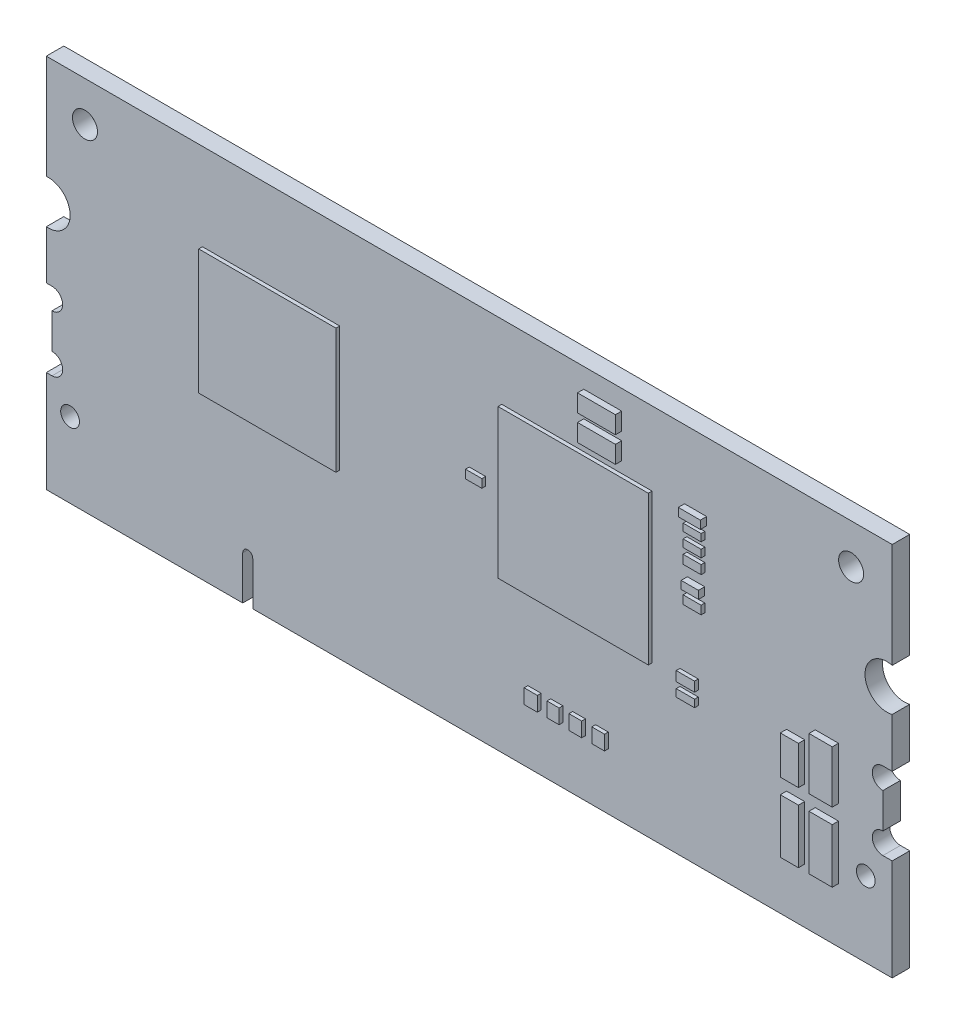
from build123d import *

# Parameters (mm, degrees)
SKETCH1_W         = 67.6
SKETCH1_H         = 30
SUBSTRATE_DEPTH   = 1.4
SKETCH2_R         = 1
SKETCH2_R_2       = 0.75
SKETCH2_R_3       = 1.75
CUTOUTS_DEPTH     = 2
SKETCH3_W         = 12.009016129
SKETCH3_H         = 11.886366808
SKETCH3_W_2       = 10.970861006
SKETCH3_H_2       = 9.979144757
CHIPS_DEPTH       = 0.3
SKETCH4_W         = 3.027468224
SKETCH4_H         = 1.391658781
SKETCH4_H_2       = 1.39165878
SKETCH4_W_2       = 1.760997679
SKETCH4_H_3       = 0.651327909
SKETCH4_W_3       = 1.447395353
SKETCH4_H_4       = 3.063653498
SKETCH4_W_4       = 1.857490704
SKETCH4_H_5       = 4.173323269
SKETCH4_H_6       = 4.331448702
SKETCH4_W_5       = 1.380452242
SKETCH4_H_7       = 0.625805016
CAPACITORS_DEPTH  = 0.5
SKETCH5_W         = 1.436881646
SKETCH5_H         = 0.57938776
SKETCH5_H_2       = 0.602563271
SKETCH5_H_3       = 0.695265312
SKETCH5_H_4       = 0.672089802
SKETCH5_W_2       = 1.465504975
SKETCH5_H_5       = 0.595361396
SKETCH5_W_3       = 1.305099019
SKETCH5_H_6       = 0.770620802
RESISTORS_DEPTH   = 0.3
SKETCH6_W         = 1.05591146
SKETCH6_H         = 1.163292287
SKETCH6_W_2       = 0.966427438
SKETCH6_W_3       = 1.020117852
SKETCH6_W_4       = 1.020117851
L_COMPONENT_DEPTH = 0.3


with BuildPart() as part:
    # Sketch1 → Substrate (new body)
    with BuildSketch(Plane.XY):
        Rectangle(SKETCH1_W, SKETCH1_H)
    extrude(amount=SUBSTRATE_DEPTH)

    # Sketch2 → Cutouts (cut)
    with BuildSketch(Plane.XY.offset(1.4)):
        with Locations((-30.709168608, 11.804578588)):
            Circle(SKETCH2_R)
        with Locations((30.516911038, 11.804578588)):
            Circle(SKETCH2_R)
        with Locations((31.687531572, -8.991184565)):
            Circle(SKETCH2_R_2)
        with Locations((-31.899083746, -8.991184565)):
            Circle(SKETCH2_R_2)
        with Locations((-33.643638543, 4.936384587)):
            Circle(SKETCH2_R_3)
        with Locations((33.376123728, 4.936384587)):
            Circle(SKETCH2_R_3)
        with BuildLine():
            Line((-18.1, -15), (-18.1, -11.517203937))
            ThreePointArc((-18.1, -11.517203937), (-17.7, -11.117203937), (-17.3, -11.517203937))
            Line((-17.3, -11.517203937), (-17.3, -15))
            Line((-17.3, -15), (-18.1, -15))
        make_face()
        with BuildLine():
            Line((33.057190194, -0.69758335), (34.638090789, -0.69758335))
            Line((34.638090789, -0.69758335), (34.710836401, -6.89758335))
            Line((34.710836401, -6.89758335), (33.057190194, -6.89758335))
            ThreePointArc((33.057190194, -6.89758335), (32.207190194, -6.04758335), (33.057190194, -5.19758335))
            Line((33.057190194, -5.19758335), (33.057190194, -2.39758335))
            ThreePointArc((33.057190194, -2.39758335), (32.207190194, -1.54758335), (33.057190194, -0.69758335))
        make_face()
        with BuildLine():
            Line((-33.341181022, -5.19758335), (-33.341181022, -2.39758335))
            ThreePointArc((-33.341181022, -2.39758335), (-32.491181022, -1.54758335), (-33.341181022, -0.69758335))
            Line((-33.341181022, -0.69758335), (-34.347477131, -0.69758335))
            Line((-34.347477131, -0.69758335), (-34.347477131, -6.89758335))
            Line((-34.347477131, -6.89758335), (-33.341181022, -6.89758335))
            ThreePointArc((-33.341181022, -6.89758335), (-32.491181022, -6.04758335), (-33.341181022, -5.19758335))
        make_face()
    extrude(amount=-CUTOUTS_DEPTH, mode=Mode.SUBTRACT)

    # Sketch3 → Chips (add)
    with BuildSketch(Plane.XY.offset(1.4)):
        with Locations((8.608474284, 3.159777946)):
            Rectangle(SKETCH3_W, SKETCH3_H)
        with Locations((-15.835757789, 3.059690457)):
            Rectangle(SKETCH3_W_2, SKETCH3_H_2)
    extrude(amount=CHIPS_DEPTH)

    # Sketch4 → Capacitors (add)
    with BuildSketch(Plane.XY.offset(1.4)):
        with Locations((10.666269416, 12.728744546)):
            Rectangle(SKETCH4_W, SKETCH4_H)
        with Locations((10.666269416, 10.677878974)):
            Rectangle(SKETCH4_W, SKETCH4_H_2)
        with Locations((18.085628066, 9.196485107)):
            Rectangle(SKETCH4_W_2, SKETCH4_H_3)
        with Locations((26.082487394, -3.540594003)):
            Rectangle(SKETCH4_W_3, SKETCH4_H_4)
        with Locations((28.579244378, -2.985759118)):
            Rectangle(SKETCH4_W_4, SKETCH4_H_5)
        with Locations((28.579244378, -8.450852566)):
            Rectangle(SKETCH4_W_4, SKETCH4_H_6)
        with Locations((26.082487394, -8.450852566)):
            Rectangle(SKETCH4_W_3, SKETCH4_H_6)
        with Locations((18.124891861, 4.272795947)):
            Rectangle(SKETCH4_W_5, SKETCH4_H_7)
    extrude(amount=CAPACITORS_DEPTH)

    # Sketch5 → Resistors (add)
    with BuildSketch(Plane.XY.offset(1.4)):
        with Locations((18.11021309, 8.134894019)):
            Rectangle(SKETCH5_W, SKETCH5_H)
        with Locations((18.11021309, 7.034057275)):
            Rectangle(SKETCH5_W, SKETCH5_H_2)
        with Locations((18.11021309, 5.921632774)):
            Rectangle(SKETCH5_W, SKETCH5_H_3)
        with Locations((18.11021309, 3.128983768)):
            Rectangle(SKETCH5_W, SKETCH5_H_4)
        with Locations((17.571973081, -3.598556709)):
            Rectangle(SKETCH5_W_2, SKETCH5_H_5)
        with Locations((0.65254951, 3.128983768)):
            Rectangle(SKETCH5_W_3, SKETCH5_H_4)
        with Locations((17.571973081, -2.438862849)):
            Rectangle(SKETCH5_W_2, SKETCH5_H_6)
    extrude(amount=RESISTORS_DEPTH)

    # Sketch6 → L Component (add)
    with BuildSketch(Plane.XY.offset(1.4)):
        with Locations((5.21332261, -9.903818455)):
            Rectangle(SKETCH6_W, SKETCH6_H)
        with Locations((6.994054649, -9.903818455)):
            Rectangle(SKETCH6_W_2, SKETCH6_H)
        with Locations((8.774786688, -9.903818455)):
            Rectangle(SKETCH6_W_3, SKETCH6_H)
        with Locations((10.600260739, -9.903818455)):
            Rectangle(SKETCH6_W_4, SKETCH6_H)
    extrude(amount=L_COMPONENT_DEPTH)


solid = part.part
